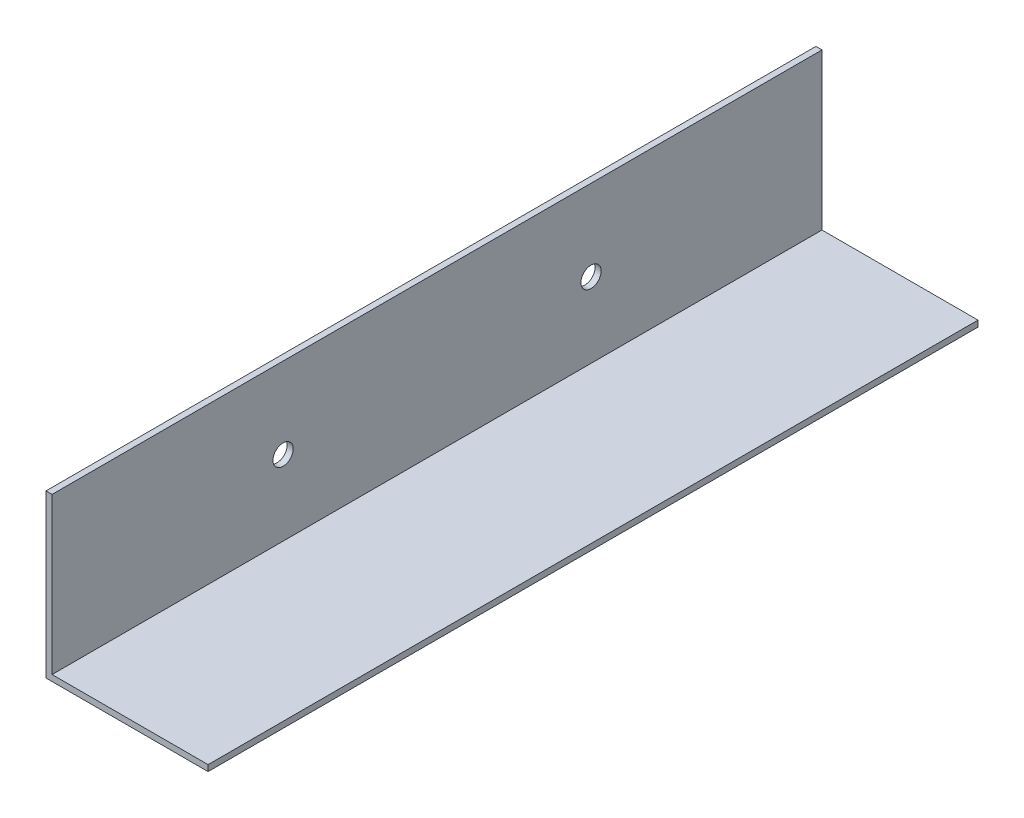
from build123d import *

# Parameters (mm, degrees)
EXTRU_MINCE1_DEPTH      = 190
ESQUISSE2_R             = 2.5
ENL_V_MAT_EXTRU_1_DEPTH = 199.242276016


with BuildPart() as part:
    # Esquisse1 → Extru.-Mince1 (new body)
    with BuildSketch(Plane.XY):
        Polygon((0, 40), (0, 0), (40, 0), (40, 1.5), (1.5, 1.5), (1.5, 40), align=None)
    extrude(amount=EXTRU_MINCE1_DEPTH)

    # Esquisse2 → Enlèv. mat.-Extru.1 (cut, through all)
    with BuildSketch(Plane.ZY):
        with Locations(Location((57, 20, 0), (0, 0, 270))):
            Circle(ESQUISSE2_R)
        with Locations(Location((133, 20, 0), (0, 0, 270))):
            Circle(ESQUISSE2_R)
    extrude(amount=-ENL_V_MAT_EXTRU_1_DEPTH, mode=Mode.SUBTRACT)


solid = part.part
